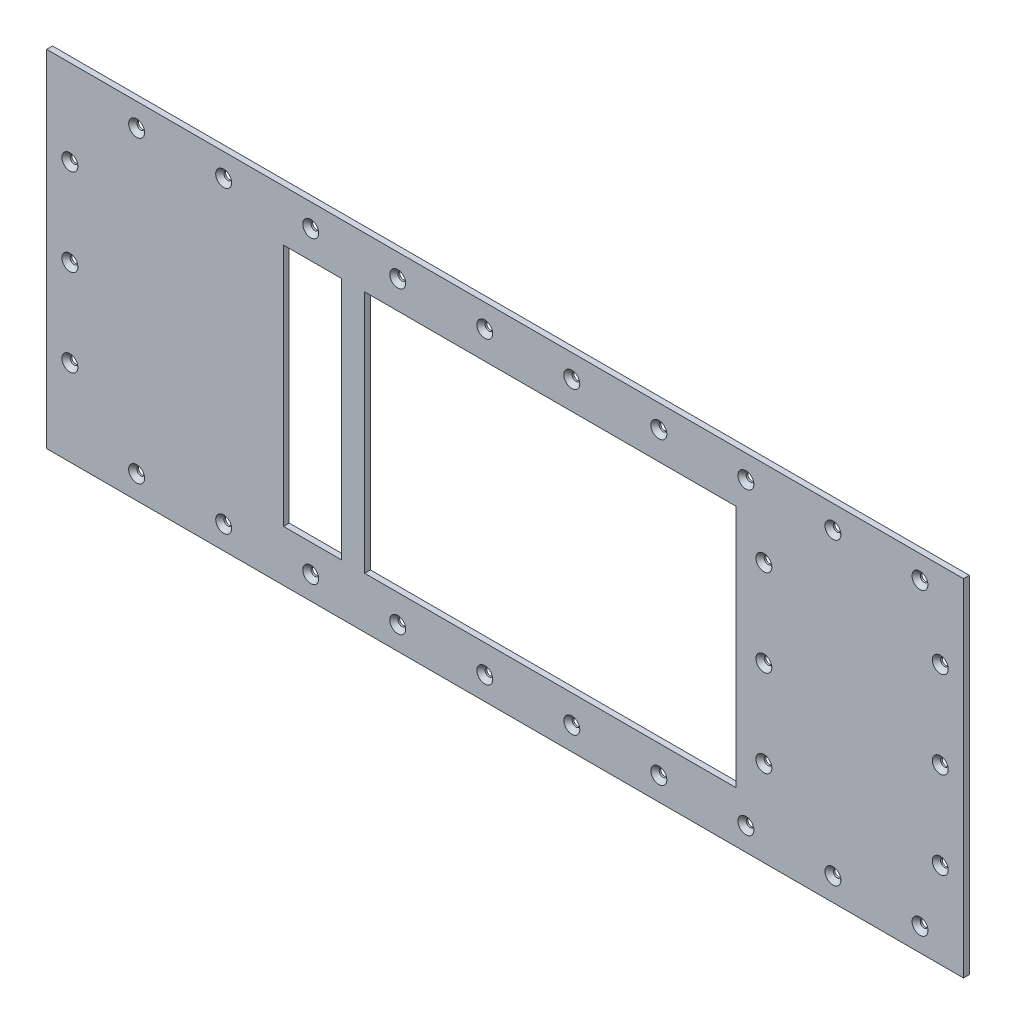
from build123d import *

# Parameters (mm, degrees)
SKETCH_1_W                  = 320
SKETCH_1_H                  = 210
SKETCH_1_W_2                = 50
EXTRUDE_1_DEPTH             = 5
HOLE_WIZARD_M61_AT_2_COUNT  = 2
HOLE_WIZARD_M61_AT_2_PITCH  = 258
HOLE_WIZARD_M61_AT_3_COUNT  = 2
HOLE_WIZARD_M61_AT_3_PITCH  = 75
HOLE_WIZARD_M61_AT_4_COUNT  = 2
HOLE_WIZARD_M61_AT_4_PITCH  = 268.680107191
HOLE_WIZARD_M61_AT_5_COUNT  = 2
HOLE_WIZARD_M61_AT_5_PITCH  = 150
HOLE_WIZARD_M61_AT_6_COUNT  = 2
HOLE_WIZARD_M61_AT_6_PITCH  = 298.435922771
HOLE_WIZARD_M61_AT_7_COUNT  = 2
HOLE_WIZARD_M61_AT_7_PITCH  = 225
HOLE_WIZARD_M61_AT_8_COUNT  = 2
HOLE_WIZARD_M61_AT_8_PITCH  = 342.328789324
HOLE_WIZARD_M61_AT_9_COUNT  = 2
HOLE_WIZARD_M61_AT_9_PITCH  = 300
HOLE_WIZARD_M61_AT_10_COUNT = 2
HOLE_WIZARD_M61_AT_10_PITCH = 395.681690251
HOLE_WIZARD_M61_AT_11_COUNT = 2
HOLE_WIZARD_M61_AT_11_PITCH = 375
HOLE_WIZARD_M61_AT_12_COUNT = 2
HOLE_WIZARD_M61_AT_12_PITCH = 455.180184103
HOLE_WIZARD_M61_AT_13_COUNT = 2
HOLE_WIZARD_M61_AT_13_PITCH = 450
HOLE_WIZARD_M61_AT_14_COUNT = 2
HOLE_WIZARD_M61_AT_14_PITCH = 518.713793917
HOLE_WIZARD_M61_AT_15_COUNT = 2
HOLE_WIZARD_M61_AT_15_PITCH = 525
HOLE_WIZARD_M61_AT_16_COUNT = 2
HOLE_WIZARD_M61_AT_16_PITCH = 584.96922996
HOLE_WIZARD_M61_AT_17_COUNT = 2
HOLE_WIZARD_M61_AT_17_PITCH = 600
HOLE_WIZARD_M61_AT_18_COUNT = 2
HOLE_WIZARD_M61_AT_18_PITCH = 653.118672218
HOLE_WIZARD_M61_AT_19_COUNT = 2
HOLE_WIZARD_M61_AT_19_PITCH = 675
HOLE_WIZARD_M61_AT_20_COUNT = 2
HOLE_WIZARD_M61_AT_20_PITCH = 722.626459521
HOLE_WIZARD_M62_AT_2_COUNT  = 2
HOLE_WIZARD_M62_AT_2_PITCH  = 598
HOLE_WIZARD_M62_AT_3_COUNT  = 2
HOLE_WIZARD_M62_AT_3_PITCH  = 750
HOLE_WIZARD_M62_AT_4_COUNT  = 2
HOLE_WIZARD_M62_AT_4_PITCH  = 75
HOLE_WIZARD_M62_AT_5_COUNT  = 2
HOLE_WIZARD_M62_AT_5_PITCH  = 602.684826423
HOLE_WIZARD_M62_AT_6_COUNT  = 2
HOLE_WIZARD_M62_AT_6_PITCH  = 753.740671584
HOLE_WIZARD_M62_AT_7_COUNT  = 2
HOLE_WIZARD_M62_AT_7_PITCH  = 150
HOLE_WIZARD_M62_AT_8_COUNT  = 2
HOLE_WIZARD_M62_AT_8_PITCH  = 616.525749665
HOLE_WIZARD_M62_AT_9_COUNT  = 2
HOLE_WIZARD_M62_AT_9_PITCH  = 764.852927039


with BuildPart() as part:
    # Эскиз1 → Бобышка-Вытянуть1 (new body)
    with BuildSketch(Plane.XY):
        Polygon((0, 0), (750, 0), (750, 298), (0, 298), (-40, 298), (-40, 0), align=None)
        with Locations((394, 149)):
            Rectangle(SKETCH_1_W, SKETCH_1_H, mode=Mode.SUBTRACT)
        with Locations((189, 149)):
            Rectangle(SKETCH_1_W_2, SKETCH_1_H, mode=Mode.SUBTRACT)
    extrude(amount=EXTRUDE_1_DEPTH)

    # Эскиз2 → Зенковка для винта с потайной головкой и внутренним шестигранником M61 (revolve, cut)
    with BuildSketch(Plane(origin=(37.5, 278, 5), x_dir=(0, -1, 0), z_dir=(1, 0, 0))):
        Polygon((0, 0), (0, 5), (3.3, 5), (3.3, 3.555), (6.855, 0), align=None)
    hole_wizard_m61 = revolve(axis=Axis((37.5, 278, 11.35), (0, 0, -1)), mode=Mode.SUBTRACT)

    # Зенковка для винта с потайной головкой и внутренним шестигранником M61 at 2: Зенковка для винта с потайной головкой и внутренним шестигранником M61 ×2
    with Locations(*[(0, -i * HOLE_WIZARD_M61_AT_2_PITCH, 0) for i in range(1, HOLE_WIZARD_M61_AT_2_COUNT)]):
        add(hole_wizard_m61, mode=Mode.SUBTRACT)

    # Зенковка для винта с потайной головкой и внутренним шестигранником M61 at 3: Зенковка для винта с потайной головкой и внутренним шестигранником M61 ×2
    with Locations(*[(i * HOLE_WIZARD_M61_AT_3_PITCH, 0, 0) for i in range(1, HOLE_WIZARD_M61_AT_3_COUNT)]):
        add(hole_wizard_m61, mode=Mode.SUBTRACT)

    # Зенковка для винта с потайной головкой и внутренним шестигранником M61 at 4: Зенковка для винта с потайной головкой и внутренним шестигранником M61 ×2
    with Locations(*[Vector(0.2791423629542125, -0.9602497285624917, 0) * (i * HOLE_WIZARD_M61_AT_4_PITCH) for i in range(1, HOLE_WIZARD_M61_AT_4_COUNT)]):
        add(hole_wizard_m61, mode=Mode.SUBTRACT)

    # Зенковка для винта с потайной головкой и внутренним шестигранником M61 at 5: Зенковка для винта с потайной головкой и внутренним шестигранником M61 ×2
    with Locations(*[(i * HOLE_WIZARD_M61_AT_5_PITCH, 0, 0) for i in range(1, HOLE_WIZARD_M61_AT_5_COUNT)]):
        add(hole_wizard_m61, mode=Mode.SUBTRACT)

    # Зенковка для винта с потайной головкой и внутренним шестигранником M61 at 6: Зенковка для винта с потайной головкой и внутренним шестигранником M61 ×2
    with Locations(*[Vector(0.5026204573745305, -0.8645071866841928, 0) * (i * HOLE_WIZARD_M61_AT_6_PITCH) for i in range(1, HOLE_WIZARD_M61_AT_6_COUNT)]):
        add(hole_wizard_m61, mode=Mode.SUBTRACT)

    # Зенковка для винта с потайной головкой и внутренним шестигранником M61 at 7: Зенковка для винта с потайной головкой и внутренним шестигранником M61 ×2
    with Locations(*[(i * HOLE_WIZARD_M61_AT_7_PITCH, 0, 0) for i in range(1, HOLE_WIZARD_M61_AT_7_COUNT)]):
        add(hole_wizard_m61, mode=Mode.SUBTRACT)

    # Зенковка для винта с потайной головкой и внутренним шестигранником M61 at 8: Зенковка для винта с потайной головкой и внутренним шестигранником M61 ×2
    with Locations(*[Vector(0.6572628625373397, -0.7536614157094831, 0) * (i * HOLE_WIZARD_M61_AT_8_PITCH) for i in range(1, HOLE_WIZARD_M61_AT_8_COUNT)]):
        add(hole_wizard_m61, mode=Mode.SUBTRACT)

    # Зенковка для винта с потайной головкой и внутренним шестигранником M61 at 9: Зенковка для винта с потайной головкой и внутренним шестигранником M61 ×2
    with Locations(*[(i * HOLE_WIZARD_M61_AT_9_PITCH, 0, 0) for i in range(1, HOLE_WIZARD_M61_AT_9_COUNT)]):
        add(hole_wizard_m61, mode=Mode.SUBTRACT)

    # Зенковка для винта с потайной головкой и внутренним шестигранником M61 at 10: Зенковка для винта с потайной головкой и внутренним шестигранником M61 ×2
    with Locations(*[Vector(0.7581851963116828, -0.6520392688280476, 0) * (i * HOLE_WIZARD_M61_AT_10_PITCH) for i in range(1, HOLE_WIZARD_M61_AT_10_COUNT)]):
        add(hole_wizard_m61, mode=Mode.SUBTRACT)

    # Зенковка для винта с потайной головкой и внутренним шестигранником M61 at 11: Зенковка для винта с потайной головкой и внутренним шестигранником M61 ×2
    with Locations(*[(i * HOLE_WIZARD_M61_AT_11_PITCH, 0, 0) for i in range(1, HOLE_WIZARD_M61_AT_11_COUNT)]):
        add(hole_wizard_m61, mode=Mode.SUBTRACT)

    # Зенковка для винта с потайной головкой и внутренним шестигранником M61 at 12: Зенковка для винта с потайной головкой и внутренним шестигранником M61 ×2
    with Locations(*[Vector(0.823849572316137, -0.5668085057535025, 0) * (i * HOLE_WIZARD_M61_AT_12_PITCH) for i in range(1, HOLE_WIZARD_M61_AT_12_COUNT)]):
        add(hole_wizard_m61, mode=Mode.SUBTRACT)

    # Зенковка для винта с потайной головкой и внутренним шестигранником M61 at 13: Зенковка для винта с потайной головкой и внутренним шестигранником M61 ×2
    with Locations(*[(i * HOLE_WIZARD_M61_AT_13_PITCH, 0, 0) for i in range(1, HOLE_WIZARD_M61_AT_13_COUNT)]):
        add(hole_wizard_m61, mode=Mode.SUBTRACT)

    # Зенковка для винта с потайной головкой и внутренним шестигранником M61 at 14: Зенковка для винта с потайной головкой и внутренним шестигранником M61 ×2
    with Locations(*[Vector(0.8675304286814686, -0.4973841124440422, 0) * (i * HOLE_WIZARD_M61_AT_14_PITCH) for i in range(1, HOLE_WIZARD_M61_AT_14_COUNT)]):
        add(hole_wizard_m61, mode=Mode.SUBTRACT)

    # Зенковка для винта с потайной головкой и внутренним шестигранником M61 at 15: Зенковка для винта с потайной головкой и внутренним шестигранником M61 ×2
    with Locations(*[(i * HOLE_WIZARD_M61_AT_15_PITCH, 0, 0) for i in range(1, HOLE_WIZARD_M61_AT_15_COUNT)]):
        add(hole_wizard_m61, mode=Mode.SUBTRACT)

    # Зенковка для винта с потайной головкой и внутренним шестигранником M61 at 16: Зенковка для винта с потайной головкой и внутренним шестигранником M61 ×2
    with Locations(*[Vector(0.8974831035743466, -0.44104883947082196, 0) * (i * HOLE_WIZARD_M61_AT_16_PITCH) for i in range(1, HOLE_WIZARD_M61_AT_16_COUNT)]):
        add(hole_wizard_m61, mode=Mode.SUBTRACT)

    # Зенковка для винта с потайной головкой и внутренним шестигранником M61 at 17: Зенковка для винта с потайной головкой и внутренним шестигранником M61 ×2
    with Locations(*[(i * HOLE_WIZARD_M61_AT_17_PITCH, 0, 0) for i in range(1, HOLE_WIZARD_M61_AT_17_COUNT)]):
        add(hole_wizard_m61, mode=Mode.SUBTRACT)

    # Зенковка для винта с потайной головкой и внутренним шестигранником M61 at 18: Зенковка для винта с потайной головкой и внутренним шестигранником M61 ×2
    with Locations(*[Vector(0.9186691875800357, -0.3950277506594155, 0) * (i * HOLE_WIZARD_M61_AT_18_PITCH) for i in range(1, HOLE_WIZARD_M61_AT_18_COUNT)]):
        add(hole_wizard_m61, mode=Mode.SUBTRACT)

    # Зенковка для винта с потайной головкой и внутренним шестигранником M61 at 19: Зенковка для винта с потайной головкой и внутренним шестигранником M61 ×2
    with Locations(*[(i * HOLE_WIZARD_M61_AT_19_PITCH, 0, 0) for i in range(1, HOLE_WIZARD_M61_AT_19_COUNT)]):
        add(hole_wizard_m61, mode=Mode.SUBTRACT)

    # Зенковка для винта с потайной головкой и внутренним шестигранником M61 at 20: Зенковка для винта с потайной головкой и внутренним шестигранником M61 ×2
    with Locations(*[Vector(0.9340925606949639, -0.35703093431007527, 0) * (i * HOLE_WIZARD_M61_AT_20_PITCH) for i in range(1, HOLE_WIZARD_M61_AT_20_COUNT)]):
        add(hole_wizard_m61, mode=Mode.SUBTRACT)

    # Эскиз4 → Зенковка для винта с потайной головкой и внутренним шестигранником M62 (revolve, cut)
    with BuildSketch(Plane(origin=(-20, 224, 5), x_dir=(0, -1, 0), z_dir=(1, 0, 0))):
        Polygon((0, 0), (0, 5), (3.3, 5), (3.3, 3.555), (6.855, 0), align=None)
    hole_wizard_m62 = revolve(axis=Axis((-20, 224, 11.35), (0, 0, -1)), mode=Mode.SUBTRACT)

    # Зенковка для винта с потайной головкой и внутренним шестигранником M62 at 2: Зенковка для винта с потайной головкой и внутренним шестигранником M62 ×2
    with Locations(*[(i * HOLE_WIZARD_M62_AT_2_PITCH, 0, 0) for i in range(1, HOLE_WIZARD_M62_AT_2_COUNT)]):
        add(hole_wizard_m62, mode=Mode.SUBTRACT)

    # Зенковка для винта с потайной головкой и внутренним шестигранником M62 at 3: Зенковка для винта с потайной головкой и внутренним шестигранником M62 ×2
    with Locations(*[(i * HOLE_WIZARD_M62_AT_3_PITCH, 0, 0) for i in range(1, HOLE_WIZARD_M62_AT_3_COUNT)]):
        add(hole_wizard_m62, mode=Mode.SUBTRACT)

    # Зенковка для винта с потайной головкой и внутренним шестигранником M62 at 4: Зенковка для винта с потайной головкой и внутренним шестигранником M62 ×2
    with Locations(*[(0, -i * HOLE_WIZARD_M62_AT_4_PITCH, 0) for i in range(1, HOLE_WIZARD_M62_AT_4_COUNT)]):
        add(hole_wizard_m62, mode=Mode.SUBTRACT)

    # Зенковка для винта с потайной головкой и внутренним шестигранником M62 at 5: Зенковка для винта с потайной головкой и внутренним шестигранником M62 ×2
    with Locations(*[Vector(0.9922267390563397, -0.12444315289168138, 0) * (i * HOLE_WIZARD_M62_AT_5_PITCH) for i in range(1, HOLE_WIZARD_M62_AT_5_COUNT)]):
        add(hole_wizard_m62, mode=Mode.SUBTRACT)

    # Зенковка для винта с потайной головкой и внутренним шестигранником M62 at 6: Зенковка для винта с потайной головкой и внутренним шестигранником M62 ×2
    with Locations(*[Vector(0.9950371902099892, -0.09950371902099892, 0) * (i * HOLE_WIZARD_M62_AT_6_PITCH) for i in range(1, HOLE_WIZARD_M62_AT_6_COUNT)]):
        add(hole_wizard_m62, mode=Mode.SUBTRACT)

    # Зенковка для винта с потайной головкой и внутренним шестигранником M62 at 7: Зенковка для винта с потайной головкой и внутренним шестигранником M62 ×2
    with Locations(*[(0, -i * HOLE_WIZARD_M62_AT_7_PITCH, 0) for i in range(1, HOLE_WIZARD_M62_AT_7_COUNT)]):
        add(hole_wizard_m62, mode=Mode.SUBTRACT)

    # Зенковка для винта с потайной головкой и внутренним шестигранником M62 at 8: Зенковка для винта с потайной головкой и внутренним шестигранником M62 ×2
    with Locations(*[Vector(0.9699513772537904, -0.24329884044827513, 0) * (i * HOLE_WIZARD_M62_AT_8_PITCH) for i in range(1, HOLE_WIZARD_M62_AT_8_COUNT)]):
        add(hole_wizard_m62, mode=Mode.SUBTRACT)

    # Зенковка для винта с потайной головкой и внутренним шестигранником M62 at 9: Зенковка для винта с потайной головкой и внутренним шестигранником M62 ×2
    with Locations(*[Vector(0.9805806756909202, -0.19611613513818404, 0) * (i * HOLE_WIZARD_M62_AT_9_PITCH) for i in range(1, HOLE_WIZARD_M62_AT_9_COUNT)]):
        add(hole_wizard_m62, mode=Mode.SUBTRACT)


solid = part.part
